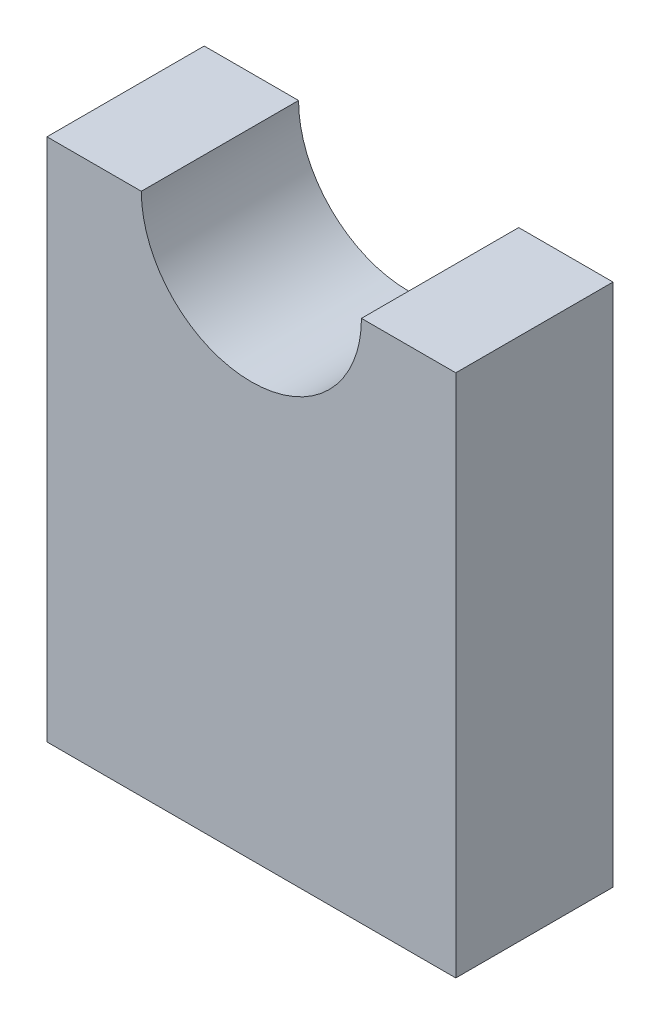
from build123d import *

# Parameters (mm, degrees)
SKETCH_1_W               = 78
SKETCH_1_H               = 30
EXTRUDE_1_DEPTH          = 100
CUT_EXTRUDE_1_DEPTH      = 109.378964749
CUT_EXTRUDE_1_DEPTH_BACK = 109.378964749
SKETCH_2_R               = 21


with BuildPart() as part:
    # 草图1 → 凸台-拉伸1 (new body)
    with BuildSketch(Plane(origin=(0, 0, 0), x_dir=(1, 0, 0), z_dir=(0, 1, 0))):
        Rectangle(SKETCH_1_W, SKETCH_1_H)
    extrude(amount=EXTRUDE_1_DEPTH)

    # 草图2 → 切除-拉伸1 (cut, two sides: drawn at the far end of the back side and taken through both)
    with BuildSketch(Plane.XY.offset(-CUT_EXTRUDE_1_DEPTH_BACK)):
        with Locations((0, 100)):
            Circle(SKETCH_2_R)
    extrude(amount=CUT_EXTRUDE_1_DEPTH + CUT_EXTRUDE_1_DEPTH_BACK, mode=Mode.SUBTRACT)


solid = part.part
